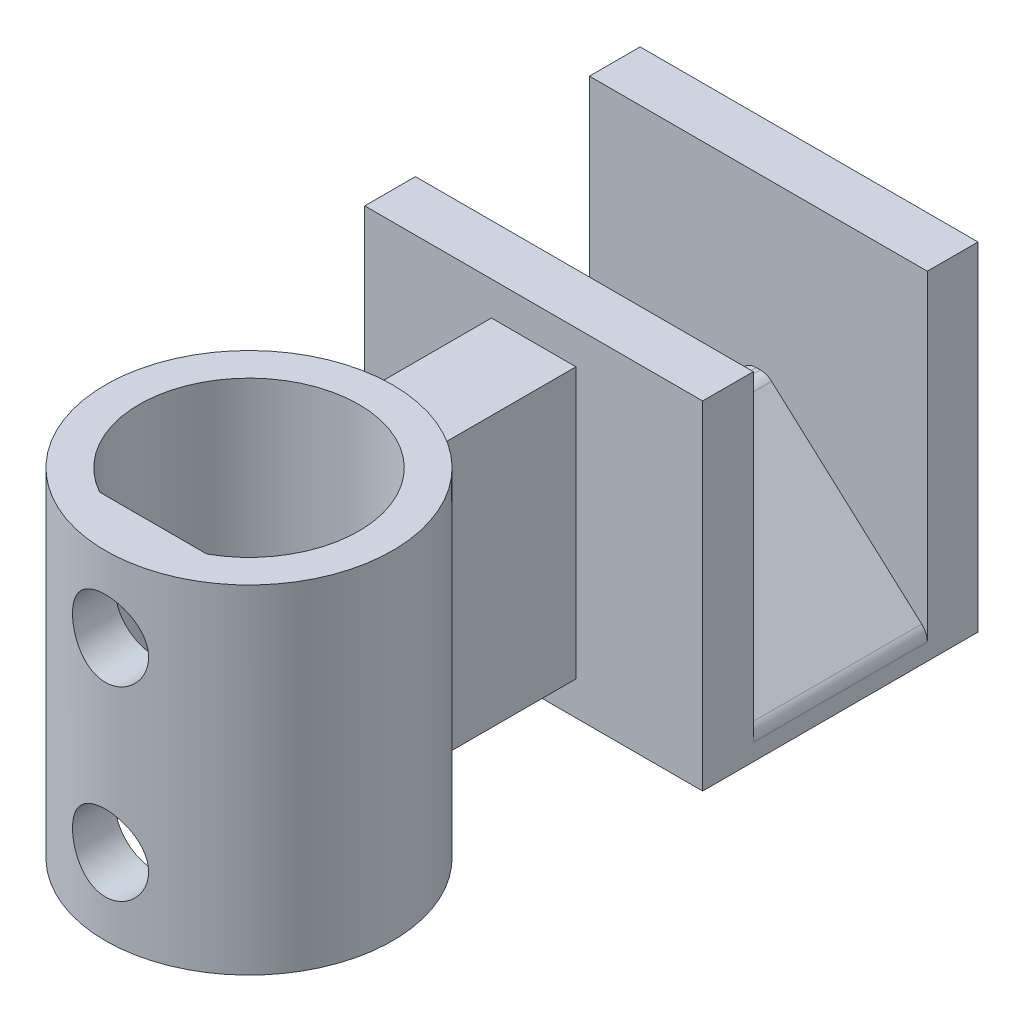
from build123d import *

# Parameters (mm, degrees)
SKETCH2_W                       = 20
SKETCH2_H                       = 10
BOSS_EXTRUDE1_DEPTH             = 5.15
CHAMFER1_SIZE                   = 9.5
CHAMFER1_SIZE2                  = 8.553838421
FILLET3_R                       = 1
SKETCH3_W                       = 20
SKETCH3_H                       = 20
BOSS_EXTRUDE2_DEPTH             = 3
BOSS_EXTRUDE3_REACH             = 21.784
SKETCH6_R                       = 8.5
BOSS_EXTRUDE3_DIRECTION_2_REACH = 21.784
BOSS_EXTRUDE4_REACH             = 33.107
BOSS_EXTRUDE4_END_RADIUS        = 8.5
SKETCH5_W                       = 5
SKETCH5_H                       = 16
CUT_EXTRUDE1_REACH              = 35.428
CUT_EXTRUDE1_END_RADIUS         = 8.5
SKETCH7_R                       = 2.25


with BuildPart() as part:
    # Sketch2 → Boss-Extrude1 (new, symmetric)
    with BuildSketch(Plane.XY):
        Rectangle(SKETCH2_W, SKETCH2_H)
    extrude(amount=BOSS_EXTRUDE1_DEPTH, both=True)

    # Chamfer1
    chamfer1_edges = [part.edges().sort_by_distance(p)[0] for p in [
        (-10, 5, 0),
        (10, 5, 0),
    ]]
    chamfer1_side = [part.faces().sort_by_distance(p)[0] for p in [
        (0, 5, 0),
    ]]
    chamfer(chamfer1_edges, length=CHAMFER1_SIZE, length2=CHAMFER1_SIZE2, reference=chamfer1_side[0])

    # Fillet3
    fillet3_edges = [part.edges().sort_by_distance(p)[0] for p in [
        (-0.5, 5, 0),
        (0.5, 5, 0),
        (10, -3.553838421, 0),
        (-10, -3.553838421, 0),
    ]]
    fillet(fillet3_edges, radius=FILLET3_R)

    # Sketch3 → Boss-Extrude2 (add)
    with BuildSketch(Plane.XY.offset(5.15)):
        with Locations((0, 5)):
            Rectangle(SKETCH3_W, SKETCH3_H)
    boss_extrude2 = extrude(amount=BOSS_EXTRUDE2_DEPTH)

    # Mirror1: Boss-Extrude2 across plane
    add(boss_extrude2.mirror(Plane.XY))


with BuildPart() as body_2:

    # Boss-Extrude3: up to this face of the body (flat: up to its plane)
    boss_extrude3_end = Plane(part.part.faces().sort_by_distance((0, 15, 6.65))[0])
    # Sketch6 → Boss-Extrude3 (new, up to the picked face)
    with BuildSketch(Plane(origin=(0, 0, 0), x_dir=(1, 0, 0), z_dir=(0, 1, 0)), mode=Mode.PRIVATE) as boss_extrude3_sk1:
        with Locations(Location((0, -25, 0), (0, 0, 90))):
            Circle(SKETCH6_R)
        with BuildLine():
            Line((3.175, -30.671805268), (-3.175, -30.671805268))
            ThreePointArc((-3.175, -30.671805268), (0, -18.5), (3.175, -30.671805268))
        make_face(mode=Mode.SUBTRACT)
    boss_extrude3_tool1 = split(extrude(boss_extrude3_sk1.sketch, amount=BOSS_EXTRUDE3_REACH, mode=Mode.PRIVATE), bisect_by=boss_extrude3_end, keep=Keep.BOTH, mode=Mode.PRIVATE)
    add(boss_extrude3_tool1.solids().sort_by(Axis((0, 0, 33.259584), (0, 1, 0)))[0])


    # Boss-Extrude3 direction 2: up to this face of the body (flat: up to its plane)
    boss_extrude3_direction_2_end = Plane(part.part.faces().sort_by_distance((0, -5, 0))[0])
    # Sketch6 → Boss-Extrude3 direction 2 (add, up to the picked face)
    with BuildSketch(Plane(origin=(0, 0, 0), x_dir=(1, 0, 0), z_dir=(0, 1, 0)), mode=Mode.PRIVATE) as boss_extrude3_direction_2_sk1:
        with Locations(Location((0, -25, 0), (0, 0, 90))):
            Circle(SKETCH6_R)
        with BuildLine():
            Line((3.175, -30.671805268), (-3.175, -30.671805268))
            ThreePointArc((-3.175, -30.671805268), (0, -18.5), (3.175, -30.671805268))
        make_face(mode=Mode.SUBTRACT)
    boss_extrude3_direction_2_tool1 = split(extrude(boss_extrude3_direction_2_sk1.sketch, amount=-BOSS_EXTRUDE3_DIRECTION_2_REACH, mode=Mode.PRIVATE), bisect_by=boss_extrude3_direction_2_end, keep=Keep.BOTH, mode=Mode.PRIVATE)
    add(boss_extrude3_direction_2_tool1.solids().sort_by(Axis((0, 0, 33.259584), (0, -1, 0)))[0])


with BuildPart() as part_1:
    add(part.part)

    add(body_2.part)  # Boss-Extrude4 merges body 2
    # Boss-Extrude4: up to this cylinder (the profile starts outside it)
    boss_extrude4_end = Plane(origin=(0, 5, 25), z_dir=(0, -1, 0)) * Cylinder(BOSS_EXTRUDE4_END_RADIUS, 84.214, mode=Mode.PRIVATE)
    # Sketch5 → Boss-Extrude4 (add, up to the surface)
    with BuildSketch(Plane.XY.offset(8.15), mode=Mode.PRIVATE) as boss_extrude4_sk1:
        with Locations((0, 5)):
            Rectangle(SKETCH5_W, SKETCH5_H)
    boss_extrude4_tool1 = extrude(boss_extrude4_sk1.sketch, amount=BOSS_EXTRUDE4_REACH, mode=Mode.PRIVATE) - boss_extrude4_end
    add(boss_extrude4_tool1.solids().sort_by_distance((0, 5, 8.15))[0])

    # Cut-Extrude1: up to this cylinder (the profile starts inside it)
    cut_extrude1_end = Plane(origin=(0, 5, 25), z_dir=(0, -1, 0)) * Cylinder(CUT_EXTRUDE1_END_RADIUS, 99.856, mode=Mode.PRIVATE)
    # Sketch7 → Cut-Extrude1 (cut, up to the surface)
    with BuildSketch(Plane.XY.offset(20), mode=Mode.PRIVATE) as cut_extrude1_sk1:
        with Locations(Location((0, 10.5, 0), (0, 0, 180))):
            Circle(SKETCH7_R)
    cut_extrude1_tool1 = extrude(cut_extrude1_sk1.sketch, amount=CUT_EXTRUDE1_REACH, mode=Mode.PRIVATE) & cut_extrude1_end
    add(cut_extrude1_tool1.solids().sort_by_distance((0, 10.5, 20))[0], mode=Mode.SUBTRACT)
    # Sketch7 → Cut-Extrude1 (cut, up to the surface)
    with BuildSketch(Plane.XY.offset(20), mode=Mode.PRIVATE) as cut_extrude1_sk2:
        with Locations(Location((0, -0.5, 0), (0, 0, 180))):
            Circle(SKETCH7_R)
    cut_extrude1_tool2 = extrude(cut_extrude1_sk2.sketch, amount=CUT_EXTRUDE1_REACH, mode=Mode.PRIVATE) & cut_extrude1_end
    add(cut_extrude1_tool2.solids().sort_by_distance((0, -0.5, 20))[0], mode=Mode.SUBTRACT)


solid = part_1.part
